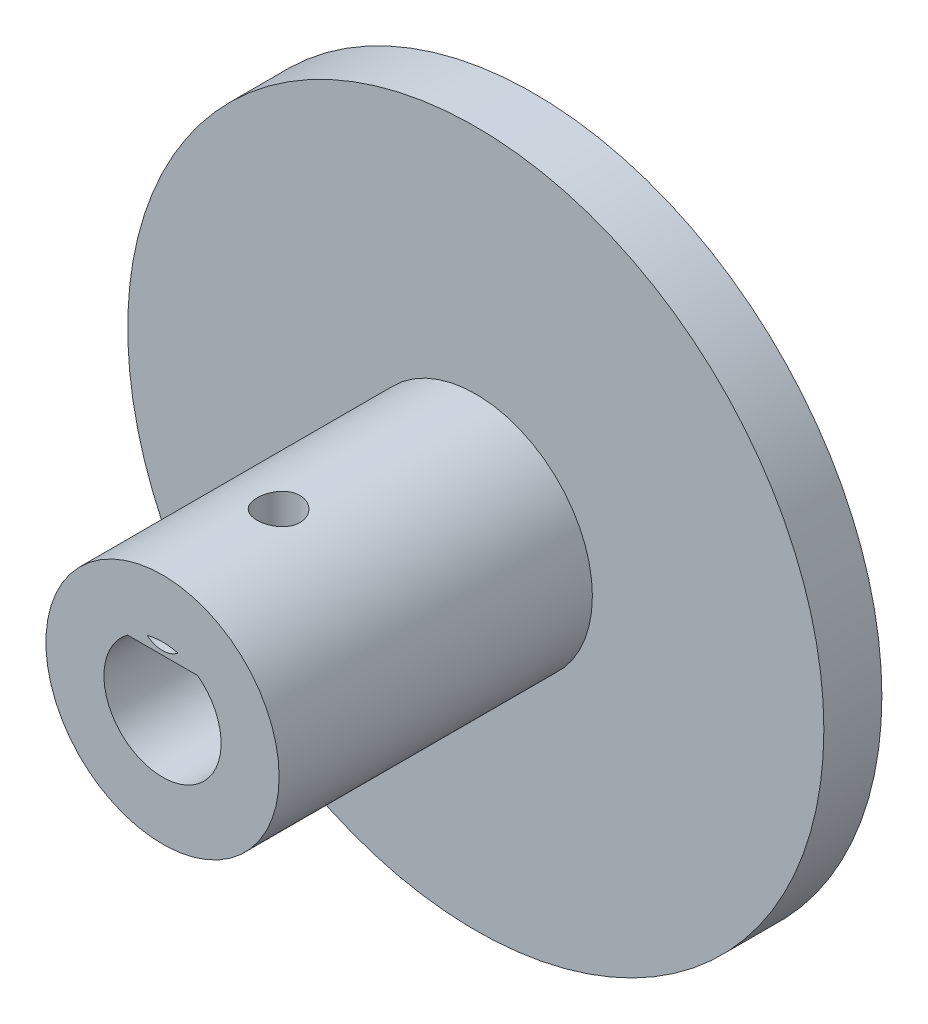
from build123d import *

# Parameters (mm, degrees)
SKETCH1_R               = 30
SKETCH1_R_2             = 2.1
BOSS_EXTRUDE1_DEPTH     = 5
SKETCH2_R               = 10.05
BOSS_EXTRUDE2_DEPTH     = 27
CUT_EXTRUDE1_DEPTH      = 20
CUT_EXTRUDE1_DEPTH_BACK = 20
SKETCH3_R               = 1.85


with BuildPart() as part:
    # Sketch1 → Boss-Extrude1 (new body)
    with BuildSketch(Plane.XY):
        Circle(SKETCH1_R)
        with Locations((0, 6.5)):
            Circle(SKETCH1_R_2, mode=Mode.SUBTRACT)
        with Locations((6, 0)):
            Circle(SKETCH1_R_2, mode=Mode.SUBTRACT)
        with Locations((0, -6.5)):
            Circle(SKETCH1_R_2, mode=Mode.SUBTRACT)
        with Locations((-6, 0)):
            Circle(SKETCH1_R_2, mode=Mode.SUBTRACT)
    extrude(amount=BOSS_EXTRUDE1_DEPTH)

    # Sketch2 → Boss-Extrude2 (add)
    with BuildSketch(Plane.XY.offset(5)):
        Circle(SKETCH2_R)
        with BuildLine():
            ThreePointArc((1.327118589, 4.8725), (0, 4.4), (-1.327118589, 4.8725))
            ThreePointArc((-1.327118589, 4.8725), (0, 5.05), (1.327118589, 4.8725))
        make_face(mode=Mode.SUBTRACT)
        with BuildLine():
            ThreePointArc((3.016620626, 4.05), (0, -5.05), (-3.016620626, 4.05))
            Line((-3.016620626, 4.05), (3.016620626, 4.05))
        make_face(mode=Mode.SUBTRACT)
    extrude(amount=BOSS_EXTRUDE2_DEPTH)

    # Sketch3 → Cut-Extrude1 (cut, two sides: drawn at the far end of the back side and taken through both)
    with BuildSketch(Plane(origin=(0, 4.05, 0), x_dir=(-1, 0, 0), z_dir=(0, -1, 0)).offset(-CUT_EXTRUDE1_DEPTH_BACK)):
        with Locations((0, -22)):
            Circle(SKETCH3_R)
    extrude(amount=CUT_EXTRUDE1_DEPTH + CUT_EXTRUDE1_DEPTH_BACK, mode=Mode.SUBTRACT)


solid = part.part
